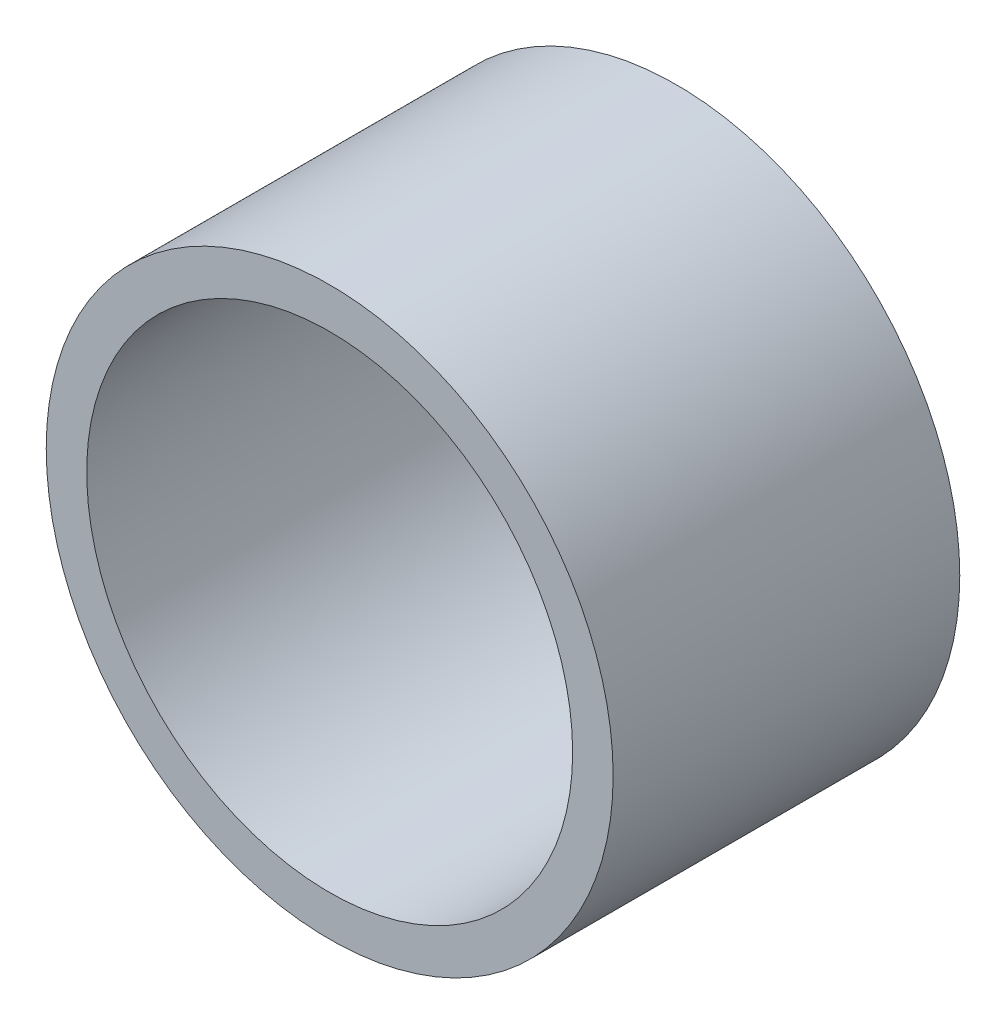
from build123d import *

# Parameters (mm, degrees)
SKETCH1_R           = 11.1125
SKETCH1_R_2         = 9.525
BOSS_EXTRUDE1_DEPTH = 13.589


with BuildPart() as part:
    # Sketch1 → Boss-Extrude1 (new body)
    with BuildSketch(Plane.XY):
        Circle(SKETCH1_R)
        Circle(SKETCH1_R_2, mode=Mode.SUBTRACT)
    extrude(amount=BOSS_EXTRUDE1_DEPTH)


solid = part.part
